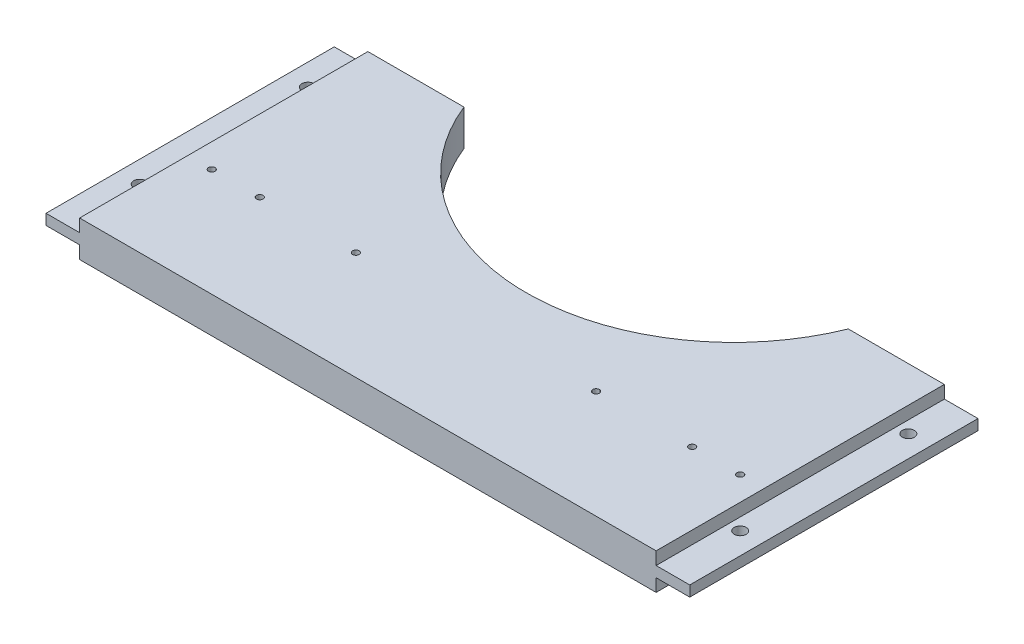
from build123d import *

# Parameters (mm, degrees)
BOSS_EXTRUDE1_DEPTH         = 9.525
F_8_32_TAPPED_HOLE1_D       = 3.4544
SKETCH6_W                   = 17.78
SKETCH6_H                   = 152.4
BOSS_EXTRUDE2_DEPTH         = 2.794
F_1_4_0_25_DIAMETER_HOLE1_D = 6.35


with BuildPart() as part:
    # Sketch1 → Boss-Extrude1 (new, symmetric)
    with BuildSketch(Plane(origin=(0, 0, 0), x_dir=(1, 0, 0), z_dir=(0, 1, 0))):
        with BuildLine():
            ThreePointArc((0, 7.62), (-61.289836841, 26.369500976), (-101.6, 76.2))
            Line((-101.6, 76.2), (-152.4, 76.2))
            Line((-152.4, 76.2), (-152.4, -76.2))
            Line((-152.4, -76.2), (152.4, -76.2))
            Line((152.4, -76.2), (152.4, 76.2))
            Line((152.4, 76.2), (101.6, 76.2))
            ThreePointArc((101.6, 76.2), (61.289836841, 26.369500976), (0, 7.62))
        make_face()
    extrude(amount=BOSS_EXTRUDE1_DEPTH, both=True)

    # #8-32 Tapped Hole1 (through all)
    with Locations(Plane(origin=(0, 9.525, 0), x_dir=(1, 0, 0), z_dir=(0, 1, 0))):
        with Locations((-139.7, -19.05), (-114.3, -19.05), (-63.5, -19.05)):
            f_8_32_tapped_hole1 = Hole(F_8_32_TAPPED_HOLE1_D / 2)

    # Mirror1: #8-32 Tapped Hole1 across plane
    add(f_8_32_tapped_hole1.mirror(Plane(origin=(0, 0, 0), x_dir=(0, 0, 1), z_dir=(1, 0, 0))), mode=Mode.SUBTRACT)

    # Sketch6 → Boss-Extrude2 (add, symmetric)
    with BuildSketch(Plane(origin=(0, 0, 0), x_dir=(1, 0, 0), z_dir=(0, 1, 0))):
        with Locations((-161.29, 0)):
            Rectangle(SKETCH6_W, SKETCH6_H)
    boss_extrude2 = extrude(amount=BOSS_EXTRUDE2_DEPTH, both=True)

    # 1/4 (0.25) Diameter Hole1 (through all)
    with Locations(Plane(origin=(0, 2.794, 0), x_dir=(1, 0, 0), z_dir=(0, 1, 0))):
        with Locations((-158.75, 50.8), (-158.75, -38.1)):
            f_1_4_0_25_diameter_hole1 = Hole(F_1_4_0_25_DIAMETER_HOLE1_D / 2)

    # Mirror2: Boss-Extrude2, 1/4 (0.25) Diameter Hole1 across plane
    add(boss_extrude2.mirror(Plane(origin=(0, 0, 0), x_dir=(0, 0, 1), z_dir=(1, 0, 0))))
    add(f_1_4_0_25_diameter_hole1.mirror(Plane(origin=(0, 0, 0), x_dir=(0, 0, 1), z_dir=(1, 0, 0))), mode=Mode.SUBTRACT)


solid = part.part
